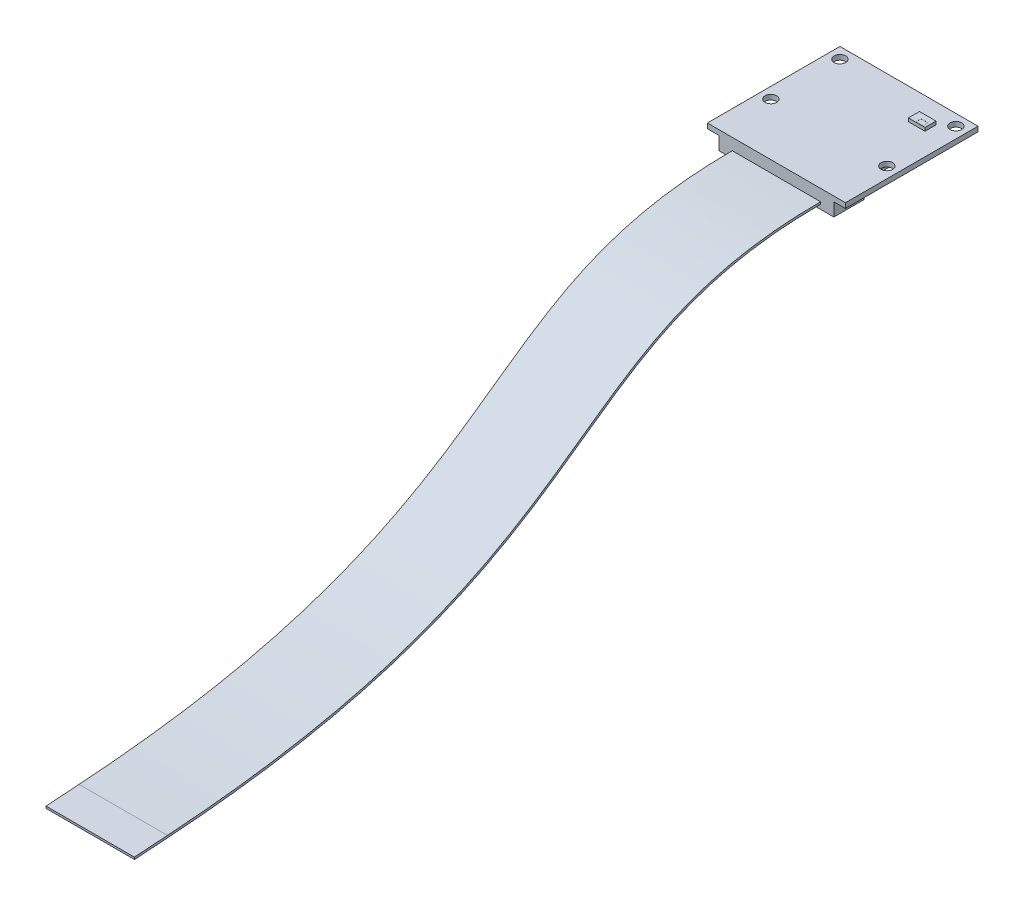
from build123d import *

# Parameters (mm, degrees)
SKIZZE1_W                                 = 25
SKIZZE1_H                                 = 24
PCB_DEPTH                                 = 0.9
SKIZZE2_R                                 = 1.05
MOUNTING_HOLES_DEPTH                      = 20.165333287
SKIZZE3_W                                 = 20.8
SKIZZE3_H                                 = 5.5
CONNECTOR_CLOSED_DEPTH                    = 2.4
SKIZZE4_W                                 = 17.7
SKIZZE4_H                                 = 11.6
COMPONENTS_WORST_CASE_BOUNDARY_BOX_DEPTH  = 1.3
SKIZZE6_W                                 = 16
SKIZZE6_H                                 = 0.4
SKIZZE7_W                                 = 3
SKIZZE7_H                                 = 2
COMPONENTS_WORST_CASE_BOUNDARY_BOX2_DEPTH = 0.6
SKIZZE8_W                                 = 1.3
SKIZZE8_H                                 = 0.9
STATUS_LED_DEPTH                          = 0.01


with BuildPart() as part:
    # Skizze1 → PCB (new body)
    with BuildSketch(Plane(origin=(0, 0, 0), x_dir=(1, 0, 0), z_dir=(0, 1, 0))):
        with Locations((0, 2.5)):
            Rectangle(SKIZZE1_W, SKIZZE1_H)
    extrude(amount=-PCB_DEPTH)

    # Skizze2 → Mounting_Holes (cut, through all)
    with BuildSketch(Plane(origin=(0, 0, 0), x_dir=(1, 0, 0), z_dir=(0, 1, 0))):
        with Locations(Location((10.5, 12.5, 0), (0, 0, 270))):
            Circle(SKIZZE2_R)
        with Locations(Location((10.5, 0, 0), (0, 0, 270))):
            Circle(SKIZZE2_R)
        with Locations(Location((-10.5, 0, 0), (0, 0, 90))):
            Circle(SKIZZE2_R)
        with Locations(Location((-10.5, 12.5, 0), (0, 0, 90))):
            Circle(SKIZZE2_R)
    extrude(amount=-MOUNTING_HOLES_DEPTH, mode=Mode.SUBTRACT)

    # Skizze3 → Connector_closed (add)
    with BuildSketch(Plane.XZ.offset(0.9)):
        with Locations((0, 6.75)):
            Rectangle(SKIZZE3_W, SKIZZE3_H)
    extrude(amount=CONNECTOR_CLOSED_DEPTH)

    # Skizze4 → Components_worst-case_Boundary-Box (add)
    with BuildSketch(Plane.XZ.offset(0.9)):
        with Locations((-0.15, -6.7)):
            Rectangle(SKIZZE4_W, SKIZZE4_H)
    extrude(amount=COMPONENTS_WORST_CASE_BOUNDARY_BOX_DEPTH)

    # Cable_156mm_free_Length: sweep along a path in Skizze5
    with BuildLine() as cable_156mm_free_length_path:  # in the path sketch's own coordinates; laid on its plane below (add() does not lay a ready-made edge on the line's plane)
        Line((-133.7358537, -42.734939928), (-127.749991329, -42.323294834))
        add(Edge.make_bspline(
            [(-127.749991329, -42.323294834), (-47.264941103, -36.788373718), (-57.962969562, -2.1), (-9.5, -2.1)],
            knots=[0, 0, 0, 0, 1, 1, 1, 1], degree=3))
    # Skizze6 → Cable_156mm_free_Length (sweep)
    with BuildSketch(Plane.XY.offset(9.5)):
        with Locations((0, -2.3)):
            Rectangle(SKIZZE6_W, SKIZZE6_H)
    sweep(path=Plane(origin=(0, 0, 0), x_dir=(0, 0, -1), z_dir=(1, 0, 0)) * cable_156mm_free_length_path.line)

    # Skizze7 → Components_worst-case_Boundary-Box2 (add)
    with BuildSketch(Plane(origin=(0, 0, 0), x_dir=(1, 0, 0), z_dir=(0, 1, 0))):
        with Locations((7, 9.9)):
            Rectangle(SKIZZE7_W, SKIZZE7_H)
    extrude(amount=COMPONENTS_WORST_CASE_BOUNDARY_BOX2_DEPTH)

    # Skizze8 → Status_LED (cut)
    with BuildSketch(Plane(origin=(0, 0.6, 0), x_dir=(1, 0, 0), z_dir=(0, 1, 0))):
        with Locations((7.45, 9.45)):
            Rectangle(SKIZZE8_W, SKIZZE8_H)
    extrude(amount=-STATUS_LED_DEPTH, mode=Mode.SUBTRACT)


solid = part.part
